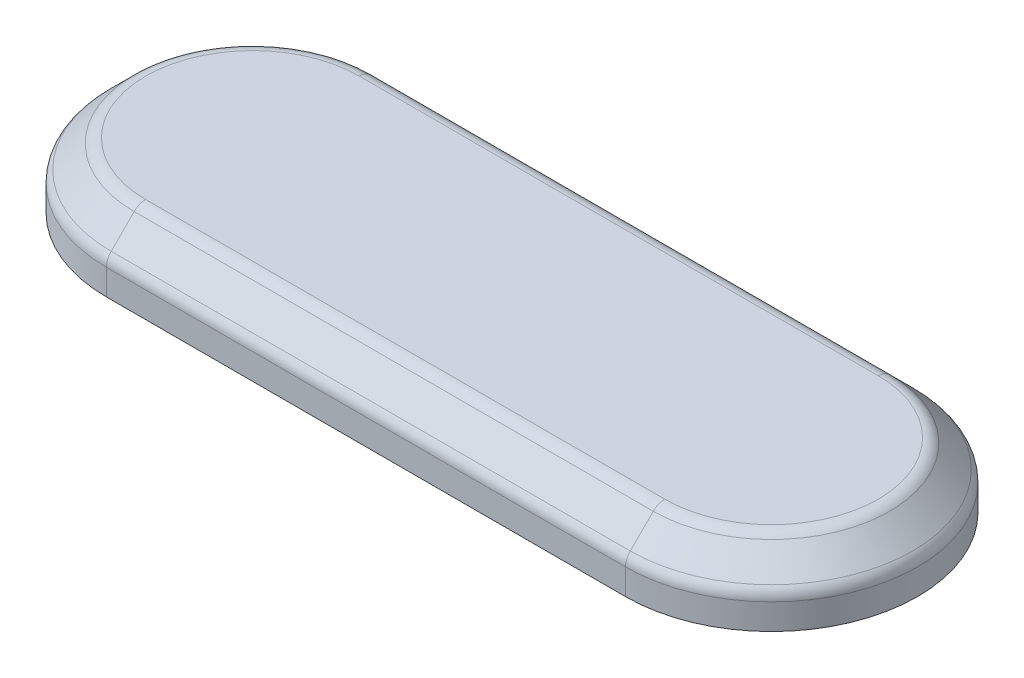
from build123d import *

# Parameters (mm, degrees)
BOSS_EXTRUDE1_DEPTH             = 2
TAP_DRILL_FOR_M3X0_5_TAP1_D     = 2.5
TAP_DRILL_FOR_M3X0_5_TAP1_DEPTH = 1
TAP_DRILL_FOR_M3X0_5_TAP1_TIP   = 0.751075774
CHAMFER3_SIZE                   = 1
FILLET1_R                       = 0.5


with BuildPart() as part:
    # Sketch1 → Boss-Extrude1 (new body)
    with BuildSketch(Plane(origin=(0, 0, 0), x_dir=(1, 0, 0), z_dir=(0, 1, 0))):
        with BuildLine():
            Line((8, -4.5), (-8, -4.5))
            ThreePointArc((-8, -4.5), (-12.5, 0), (-8, 4.5))
            Line((-8, 4.5), (8, 4.5))
            ThreePointArc((8, 4.5), (12.5, 0), (8, -4.5))
        make_face()
    extrude(amount=BOSS_EXTRUDE1_DEPTH)

    # Tap Drill for M3x0.5 Tap1
    with Locations(Plane.XZ):
        with Locations((-8, 0), (8, 0)):
            Hole(TAP_DRILL_FOR_M3X0_5_TAP1_D / 2, depth=TAP_DRILL_FOR_M3X0_5_TAP1_DEPTH)
            with Locations((0, 0, -(TAP_DRILL_FOR_M3X0_5_TAP1_DEPTH + TAP_DRILL_FOR_M3X0_5_TAP1_TIP / 2))):  # 118° drill point
                Cone(0, TAP_DRILL_FOR_M3X0_5_TAP1_D / 2, TAP_DRILL_FOR_M3X0_5_TAP1_TIP, mode=Mode.SUBTRACT)

    # Chamfer3
    chamfer3_edges = [part.edges().sort_by_distance(p)[0] for p in [
        (12.5, 2, 0),
        (0, 2, -4.5),
        (-12.5, 2, 0),
        (0, 2, 4.5),
    ]]
    chamfer(chamfer3_edges, length=CHAMFER3_SIZE)

    # Fillet1
    fillet1_edges = [part.edges().sort_by_distance(p)[0] for p in [
        (0, 2, 3.5),
        (11.5, 2, 0),
        (-11.5, 2, 0),
        (0, 2, -3.5),
        (0, 1, -4.5),
        (-12.5, 1, 0),
        (12.5, 1, 0),
        (0, 1, 4.5),
    ]]
    fillet(fillet1_edges, radius=FILLET1_R)


solid = part.part
